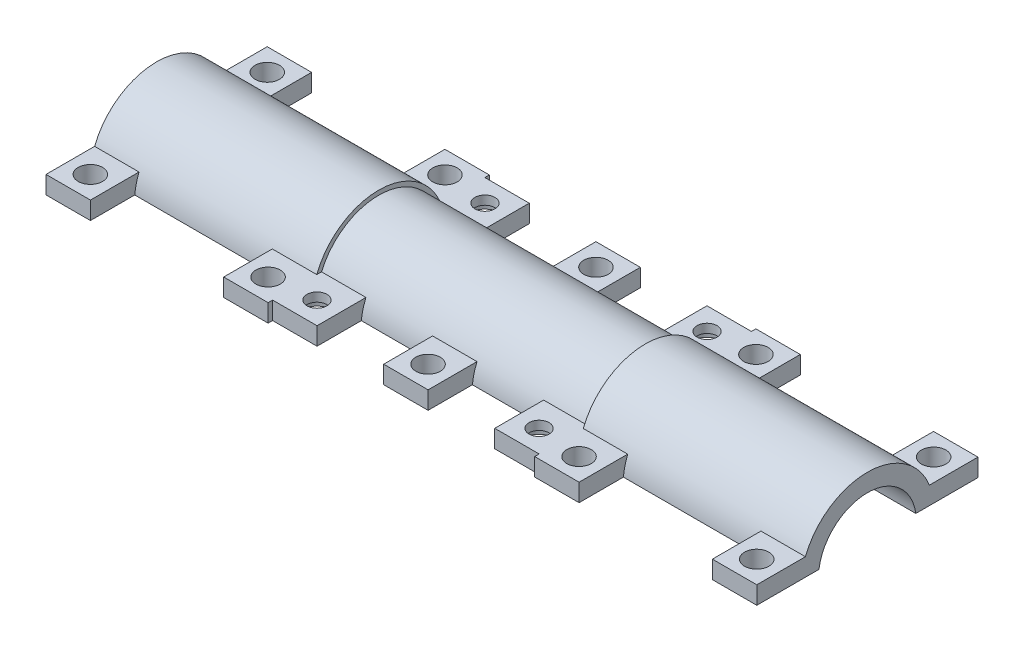
from build123d import *

# Parameters (mm, degrees)
BOSS_EXTRUDE2_DEPTH = 30
SKETCH2_W           = 10
SKETCH2_H           = 14
SKETCH2_R           = 2.25
SKETCH2_R_2         = 2.75
BOSS_EXTRUDE3_DEPTH = 4
SKETCH6_R           = 4
CUT_EXTRUDE1_DEPTH  = 2
BOSS_EXTRUDE4_DEPTH = 50
SKETCH8_W           = 10
SKETCH8_H           = 14
SKETCH8_R           = 2.75
BOSS_EXTRUDE5_DEPTH = 4


with BuildPart() as part:
    # Sketch1 → Boss-Extrude2 (new, symmetric)
    with BuildSketch(Plane(origin=(0, 0, 0), x_dir=(0, 0, -1), z_dir=(1, 0, 0))):
        with BuildLine():
            Line((-13.919410907, 1.5), (-9.886859967, 1.5))
            ThreePointArc((-9.886859967, 1.5), (0, 10), (9.886859967, 1.5))
            Line((9.886859967, 1.5), (13.919410907, 1.5))
            ThreePointArc((13.919410907, 1.5), (0, 14), (-13.919410907, 1.5))
        make_face()
    extrude(amount=BOSS_EXTRUDE2_DEPTH, both=True)

    # Sketch2 → Boss-Extrude3 (add)
    # profile 1 of 6: a face of its own
    with BuildSketch(Plane.XZ.offset(-1.5)):
        with Locations((-25, -16.886859967)):
            Rectangle(SKETCH2_W, SKETCH2_H)
        with Locations(Location((-25, -18.903135437, 0), (0, 0, 270))):
            Circle(SKETCH2_R, mode=Mode.SUBTRACT)
    # profile 2 of 6: a face of its own
    with BuildSketch(Plane.XZ.offset(-1.5)):
        with Locations((25, -16.886859967)):
            Rectangle(SKETCH2_W, SKETCH2_H)
        with Locations(Location((25, -18.903135437, 0), (0, 0, 270))):
            Circle(SKETCH2_R, mode=Mode.SUBTRACT)
    # profile 3 of 6: a face of its own
    with BuildSketch(Plane.XZ.offset(-1.5)):
        with Locations((-25, 16.886859967)):
            Rectangle(SKETCH2_W, SKETCH2_H)
        with Locations(Location((-25, 18.903135437, 0), (0, 0, 270))):
            Circle(SKETCH2_R, mode=Mode.SUBTRACT)
    # profile 4 of 6: a face of its own
    with BuildSketch(Plane.XZ.offset(-1.5)):
        with Locations((25, 16.886859967)):
            Rectangle(SKETCH2_W, SKETCH2_H)
        with Locations(Location((25, 18.903135437, 0), (0, 0, 270))):
            Circle(SKETCH2_R, mode=Mode.SUBTRACT)
    # profile 5 of 6: a face of its own
    with BuildSketch(Plane.XZ.offset(-1.5)):
        with Locations((0, 16.886859967)):
            Rectangle(SKETCH2_W, SKETCH2_H)
        with Locations(Location((0, 18.903135437, 0), (0, 0, 270))):
            Circle(SKETCH2_R_2, mode=Mode.SUBTRACT)
    # profile 6 of 6: a face of its own
    with BuildSketch(Plane.XZ.offset(-1.5)):
        with Locations((0, -16.886859967)):
            Rectangle(SKETCH2_W, SKETCH2_H)
        with Locations(Location((0, -18.903135437, 0), (0, 0, 90))):
            Circle(SKETCH2_R_2, mode=Mode.SUBTRACT)
    extrude(amount=-BOSS_EXTRUDE3_DEPTH)

    # Sketch6 → Cut-Extrude1 (cut)
    with BuildSketch(Plane.XZ.offset(-1.5)):
        with Locations(Location((-25, 18.903135437, 0), (0, 0, 270))):
            Circle(SKETCH6_R)
        with Locations(Location((25, -18.903135437, 0), (0, 0, 270))):
            Circle(SKETCH6_R)
        with Locations(Location((-25, -18.903135437, 0), (0, 0, 270))):
            Circle(SKETCH6_R)
        with Locations(Location((25, 18.903135437, 0), (0, 0, 270))):
            Circle(SKETCH6_R)
    extrude(amount=-CUT_EXTRUDE1_DEPTH, mode=Mode.SUBTRACT)

    # Sketch7 → Boss-Extrude4 (add)
    with BuildSketch(Plane.ZY.offset(30)):
        with BuildLine():
            Line((-14.924811557, 1.5), (-10.897247359, 1.5))
            ThreePointArc((-10.897247359, 1.5), (0, 11), (10.897247359, 1.5))
            Line((10.897247359, 1.5), (14.924811557, 1.5))
            ThreePointArc((14.924811557, 1.5), (0, 15), (-14.924811557, 1.5))
        make_face()
    boss_extrude4 = extrude(amount=BOSS_EXTRUDE4_DEPTH)

    # Sketch8 → Boss-Extrude5 (add)
    # profile 1 of 4: a face of its own
    with BuildSketch(Plane.XZ.offset(-1.5)):
        with Locations((-75, 17.897247359)):
            Rectangle(SKETCH8_W, SKETCH8_H)
        with Locations(Location((-75, 19.911029458, 0), (0, 0, 270))):
            Circle(SKETCH8_R, mode=Mode.SUBTRACT)
    # profile 2 of 4: a face of its own
    with BuildSketch(Plane.XZ.offset(-1.5)):
        with Locations((-35, 17.897247359)):
            Rectangle(SKETCH8_W, SKETCH8_H)
        with Locations(Location((-35, 19.911029458, 0), (0, 0, 90))):
            Circle(SKETCH8_R, mode=Mode.SUBTRACT)
    # profile 3 of 4: a face of its own
    with BuildSketch(Plane.XZ.offset(-1.5)):
        with Locations((-75, -17.897247359)):
            Rectangle(SKETCH8_W, SKETCH8_H)
        with Locations(Location((-75, -19.911029458, 0), (0, 0, 90))):
            Circle(SKETCH8_R, mode=Mode.SUBTRACT)
    # profile 4 of 4: a face of its own
    with BuildSketch(Plane.XZ.offset(-1.5)):
        with Locations((-35, -17.897247359)):
            Rectangle(SKETCH8_W, SKETCH8_H)
        with Locations(Location((-35, -19.911029458, 0), (0, 0, 270))):
            Circle(SKETCH8_R, mode=Mode.SUBTRACT)
    boss_extrude5 = extrude(amount=-BOSS_EXTRUDE5_DEPTH)

    # Mirror1: Boss-Extrude4, Boss-Extrude5 across plane
    add(boss_extrude4.mirror(Plane(origin=(0, 0, 0), x_dir=(0, 0, 1), z_dir=(1, 0, 0))))
    add(boss_extrude5.mirror(Plane(origin=(0, 0, 0), x_dir=(0, 0, 1), z_dir=(1, 0, 0))))


solid = part.part
